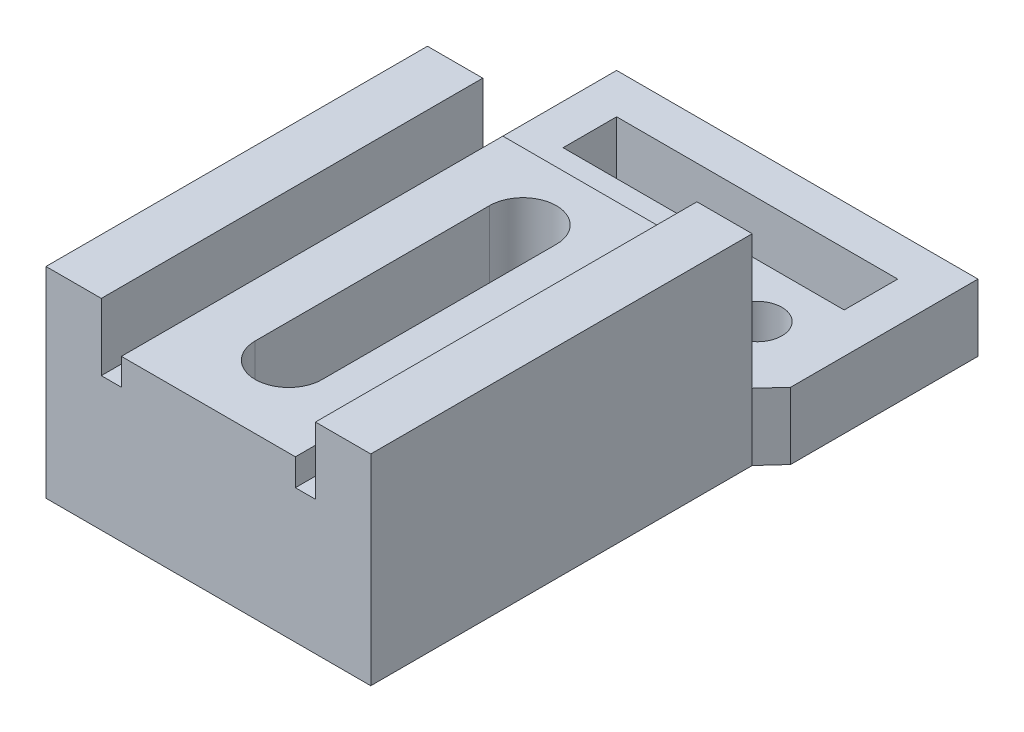
from build123d import *

# Parameters (mm, degrees)
CROQUIS1_W                    = 30
CROQUIS1_H                    = 10
SALIENTE_EXTRUIR1_DEPTH       = 18
CROQUIS2_W                    = 16
CROQUIS2_H                    = 3
CORTAR_EXTRUIR1_DEPTH         = 39.831471343
DI_METRO_DE_TALADRO_5_0_5_1_D = 5
DI_METRO_DE_TALADRO_5_0_5_2_D = 5
SALIENTE_EXTRUIR2_START       = 5
CROQUIS7_W                    = 18
CROQUIS7_H                    = 30
CROQUIS7_R                    = 2.5
CROQUIS7_R_2                  = 1.85
SALIENTE_EXTRUIR2_DEPTH       = 5
CORTAR_EXTRUIR3_REACH         = 99.487
CROQUIS9_W                    = 21
CROQUIS9_H                    = 4
CORTAR_EXTRUIR4_REACH         = 98.671
CROQUIS12_W                   = 1.5
CROQUIS12_H                   = 10
CROQUIS11_W                   = 3.131833875
CROQUIS11_H                   = 28.5
SALIENTE_EXTRUIR4_DEPTH       = 15
CROQUIS13_W                   = 1.5
CROQUIS13_H                   = 28.5
CORTAR_EXTRUIR5_DEPTH         = 2
CORTAR_EXTRUIR6_START         = -12
CORTAR_EXTRUIR6_DEPTH         = 15
SALIENTE_EXTRUIR5_DEPTH       = 5


with BuildPart() as part:
    # Croquis1 → Saliente-Extruir1 (new body)
    with BuildSketch(Plane(origin=(0, 0, 0), x_dir=(0, 0, -1), z_dir=(1, 0, 0))):
        with Locations((64.661633078, 1.848832797)):
            Rectangle(CROQUIS1_W, CROQUIS1_H)
    extrude(amount=-SALIENTE_EXTRUIR1_DEPTH)

    # Croquis2 → Cortar-Extruir1 (cut, through all)
    with BuildSketch(Plane(origin=(0, 13.697665595, -49.661633078), x_dir=(1, 0, 0), z_dir=(0, 0, -1))):
        with Locations((-9, 8.348832797)):
            Rectangle(CROQUIS2_W, CROQUIS2_H)
    extrude(amount=CORTAR_EXTRUIR1_DEPTH, mode=Mode.SUBTRACT)

    # Diámetro de taladro Ø5.0 (5)1 (through all)
    with Locations(Plane(origin=(0, 3.848832797, 0), x_dir=(1, 0, 0), z_dir=(0, 1, 0))):
        with Locations((-9, 65.161633078)):
            Hole(DI_METRO_DE_TALADRO_5_0_5_1_D / 2)

    # Diámetro de taladro Ø5.0 (5)2 (through all)
    with Locations(Plane(origin=(0, 3.848832797, 0), x_dir=(1, 0, 0), z_dir=(0, 1, 0))):
        with Locations((-9, 73.161633078)):
            Hole(DI_METRO_DE_TALADRO_5_0_5_2_D / 2)

    # Croquis7 → Saliente-Extruir2 (add)
    # profile 1 of 2: a face of its own
    with BuildSketch(Plane.XZ.offset(3.151167203).offset(SALIENTE_EXTRUIR2_START)):
        with Locations((-9, -64.661633078)):
            Rectangle(CROQUIS7_W, CROQUIS7_H)
        with Locations(Location((-9, -65.161633078, 0), (0, 0, 90))):
            Circle(CROQUIS7_R, mode=Mode.SUBTRACT)
        with Locations(Location((-9, -73.161633078, 0), (0, 0, 90))):
            Circle(CROQUIS7_R, mode=Mode.SUBTRACT)
    # profile 2 of 2: a face of its own
    with BuildSketch(Plane.XZ.offset(3.151167203).offset(SALIENTE_EXTRUIR2_START)):
        Polygon((0, -79.661633078), (4.5, -79.661633078), (4.5, -93.661633078), (-22.5, -93.661633078), (-22.5, -79.661633078), (-18, -79.661633078), align=None)
        with Locations(Location((-17, -82.661633078, 0), (0, 0, 270))):
            Circle(CROQUIS7_R_2, mode=Mode.SUBTRACT)
        with Locations(Location((-1, -82.661633078, 0), (0, 0, 270))):
            Circle(CROQUIS7_R_2, mode=Mode.SUBTRACT)
    extrude(amount=-SALIENTE_EXTRUIR2_DEPTH)

    # Croquis9 → Cortar-Extruir3 (cut, up to next)
    with BuildSketch(Plane(origin=(0, -8.151167203, 0), x_dir=(-1, 0, 0), z_dir=(0, -1, 0)), mode=Mode.PRIVATE) as cortar_extruir3_sk1:
        with Locations((9, 88.661633078)):
            Rectangle(CROQUIS9_W, CROQUIS9_H)
    cortar_extruir3_tool1 = extrude(cortar_extruir3_sk1.sketch, amount=-CORTAR_EXTRUIR3_REACH, mode=Mode.PRIVATE) & part.part
    add(cortar_extruir3_tool1.solids().sort_by_distance((-9, -8.151167, -88.661633))[0], mode=Mode.SUBTRACT)

    # Croquis12 → Cortar-Extruir4 (cut, up to next)
    with BuildSketch(Plane.ZY.offset(18), mode=Mode.PRIVATE) as cortar_extruir4_sk1:
        with Locations((-78.911633078, 1.848832797)):
            Rectangle(CROQUIS12_W, CROQUIS12_H)
    cortar_extruir4_tool1 = extrude(cortar_extruir4_sk1.sketch, amount=-CORTAR_EXTRUIR4_REACH, mode=Mode.PRIVATE) & part.part
    add(cortar_extruir4_tool1.solids().sort_by_distance((-18, 1.848833, -78.911633))[0], mode=Mode.SUBTRACT)

    # Croquis11 → Saliente-Extruir4 (add)
    with BuildSketch(Plane(origin=(0, 6.848832797, 0), x_dir=(1, 0, 0), z_dir=(0, 1, 0))):
        with Locations((-19.565916937, 63.911633078)):
            Rectangle(CROQUIS11_W, CROQUIS11_H)
        with Locations((1.565916938, 63.911633078)):
            Rectangle(CROQUIS11_W, CROQUIS11_H)
    extrude(amount=-SALIENTE_EXTRUIR4_DEPTH)

    # Croquis13 → Cortar-Extruir5 (cut)
    with BuildSketch(Plane(origin=(0, 3.848832797, 0), x_dir=(1, 0, 0), z_dir=(0, 1, 0))):
        with Locations((-16.25, 63.911633078)):
            Rectangle(CROQUIS13_W, CROQUIS13_H)
        with Locations((-1.75, 63.911633078)):
            Rectangle(CROQUIS13_W, CROQUIS13_H)
    extrude(amount=-CORTAR_EXTRUIR5_DEPTH, mode=Mode.SUBTRACT)

    # Croquis14 → Cortar-Extruir6 (cut)
    with BuildSketch(Plane(origin=(0, 3.848832797, 0), x_dir=(1, 0, 0), z_dir=(0, 1, 0)).offset(CORTAR_EXTRUIR6_START)):
        with BuildLine():
            Line((-6.5, 55.661633078), (-6.5, 73.161633078))
            ThreePointArc((-6.5, 73.161633078), (-9, 75.661633078), (-11.5, 73.161633078))
            Line((-11.5, 73.161633078), (-11.5, 55.661633078))
            ThreePointArc((-11.5, 55.661633078), (-9, 53.161633078), (-6.5, 55.661633078))
        make_face()
    extrude(amount=CORTAR_EXTRUIR6_DEPTH, mode=Mode.SUBTRACT)

    # Croquis15 → Saliente-Extruir5 (add)
    with BuildSketch(Plane(origin=(0, -3.151167203, 0), x_dir=(1, 0, 0), z_dir=(0, 1, 0))):
        Polygon((-18, 78.161633078), (-18, 79.661633078), (-22.5, 79.661633078), (-21.131833875, 78.161633078), align=None)
        Polygon((0, 78.161633078), (3.131833875, 78.161633078), (4.5, 79.661633078), (0, 79.661633078), align=None)
    extrude(amount=-SALIENTE_EXTRUIR5_DEPTH)


solid = part.part
